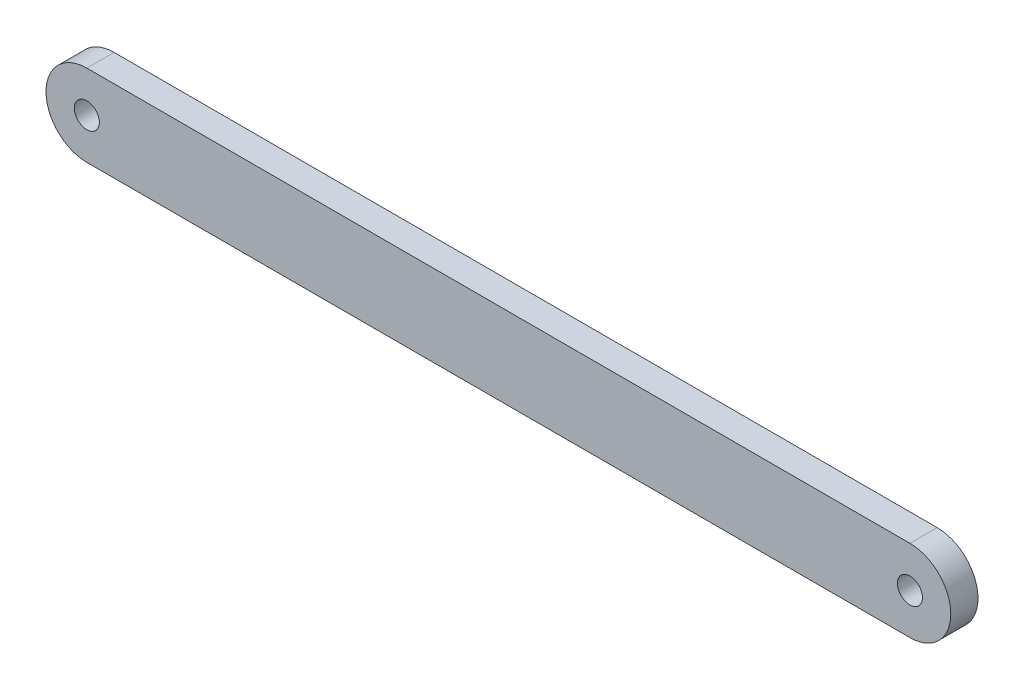
from build123d import *

# Parameters (mm, degrees)
SKETCH_1_R      = 2.3
EXTRUDE_1_DEPTH = 5


with BuildPart() as part:
    # 草图1 → 凸台-拉伸1 (new body)
    with BuildSketch(Plane.XY):
        with BuildLine():
            Line((-75.6, 7.5), (75.6, 7.5))
            ThreePointArc((75.6, 7.5), (83.1, 0), (75.6, -7.5))
            Line((75.6, -7.5), (-75.6, -7.5))
            ThreePointArc((-75.6, -7.5), (-83.1, 0), (-75.6, 7.5))
        make_face()
        with Locations((-75.6, 0)):
            Circle(SKETCH_1_R, mode=Mode.SUBTRACT)
        with Locations((75.6, 0)):
            Circle(SKETCH_1_R, mode=Mode.SUBTRACT)
    extrude(amount=EXTRUDE_1_DEPTH)


solid = part.part
